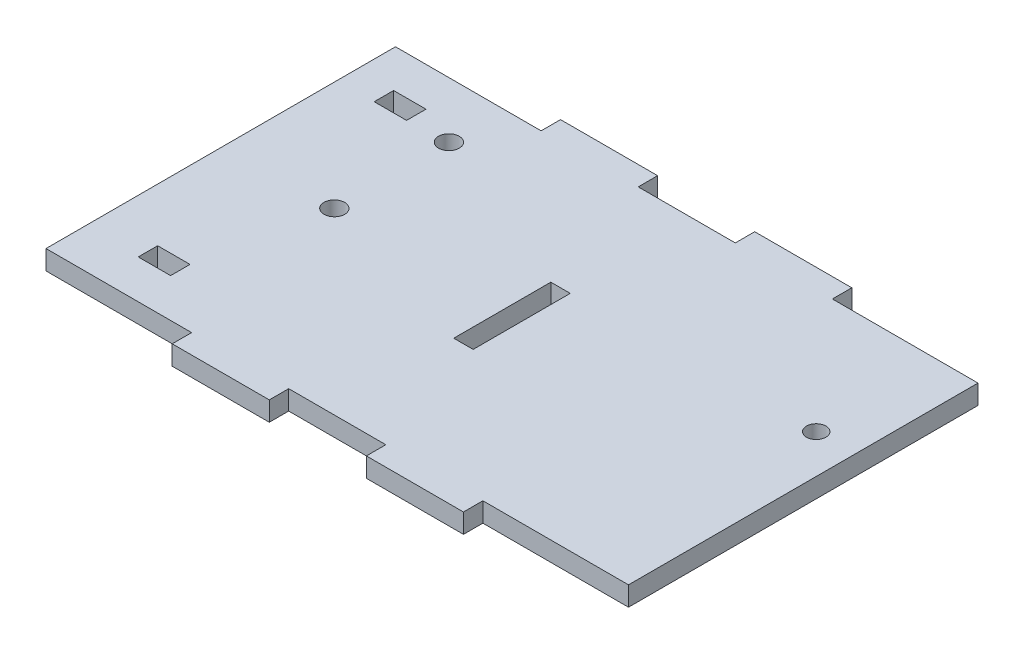
from build123d import *

# Parameters (mm, degrees)
BOSS_EXTRUDE1_DEPTH = 3
SKETCH3_W           = 5
SKETCH3_H           = 3
CUT_EXTRUDE2_DEPTH  = 55.166410256
SKETCH4_W           = 3
SKETCH4_H           = 15
CUT_EXTRUDE3_DEPTH  = 55.166410256
SKETCH5_R           = 1.5
CUT_EXTRUDE4_DEPTH  = 55.166410256
SKETCH6_R           = 1.6
CUT_EXTRUDE5_DEPTH  = 55.166410256


with BuildPart() as part:
    # Sketch1 → Boss-Extrude1 (new body)
    with BuildSketch(Plane(origin=(0, 0, 0), x_dir=(1, 0, 0), z_dir=(0, 1, 0))):
        Polygon((-45, 27), (-22.5, 27), (-22.5, 30), (-7.5, 30), (-7.5, 27), (7.5, 27), (7.5, 30), (22.5, 30), (22.5, 27), (45, 27), (45, -27), (22.5, -27), (22.5, -30), (7.5, -30), (7.5, -27), (-7.5, -27), (-7.5, -30), (-22.5, -30), (-22.5, -27), (-45, -27), align=None)
    extrude(amount=BOSS_EXTRUDE1_DEPTH)

    # Sketch3 → Cut-Extrude2 (cut, through all)
    with BuildSketch(Plane(origin=(0, 3, 0), x_dir=(1, 0, 0), z_dir=(0, 1, 0))):
        with Locations((-34.25, -19.5)):
            Rectangle(SKETCH3_W, SKETCH3_H)
        with Locations((-36.79, 19.5)):
            Rectangle(SKETCH3_W, SKETCH3_H)
    extrude(amount=-CUT_EXTRUDE2_DEPTH, mode=Mode.SUBTRACT)

    # Sketch4 → Cut-Extrude3 (cut, through all)
    with BuildSketch(Plane(origin=(0, 3, 0), x_dir=(1, 0, 0), z_dir=(0, 1, 0))):
        Rectangle(SKETCH4_W, SKETCH4_H)
    extrude(amount=-CUT_EXTRUDE3_DEPTH, mode=Mode.SUBTRACT)

    # Sketch5 → Cut-Extrude4 (cut, through all)
    with BuildSketch(Plane(origin=(0, 3, 0), x_dir=(1, 0, 0), z_dir=(0, 1, 0))):
        with Locations(Location((39, 8, 0), (0, 0, 270))):
            Circle(SKETCH5_R)
    extrude(amount=-CUT_EXTRUDE4_DEPTH, mode=Mode.SUBTRACT)

    # Sketch6 → Cut-Extrude5 (cut, through all)
    with BuildSketch(Plane(origin=(0, 3, 0), x_dir=(1, 0, 0), z_dir=(0, 1, 0))):
        with Locations(Location((-28.1, 18.35, 0), (0, 0, 270))):
            Circle(SKETCH6_R)
        with Locations(Location((-28.1, 0.65, 0), (0, 0, 270))):
            Circle(SKETCH6_R)
    extrude(amount=-CUT_EXTRUDE5_DEPTH, mode=Mode.SUBTRACT)


solid = part.part
